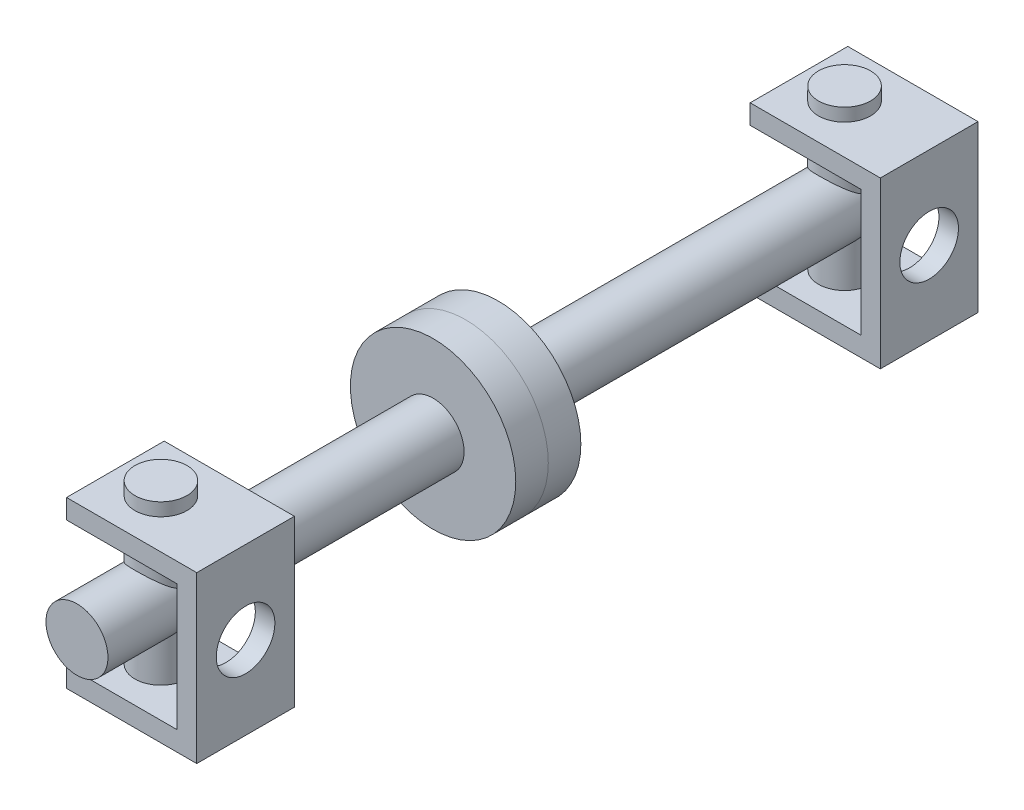
from build123d import *

# Parameters (mm, degrees)
BOSS_EXTRUDE1_DEPTH       = 15
SKETCH2_R                 = 4.5
CUT_EXTRUDE1_DEPTH        = 15
SKETCH3_R                 = 4
CUT_EXTRUDE2_DEPTH        = 36.639304146
BOSS_EXTRUDE2_DEPTH       = 2
BOSS_EXTRUDE2_DEPTH_BACK  = 27
SKETCH4_R                 = 4
SKETCH5_R                 = 2.5
CUT_EXTRUDE3_DEPTH        = 27
BOSS_EXTRUDE3_DEPTH       = 45.7
BOSS_EXTRUDE3_DEPTH_BACK  = 14
SKETCH6_R                 = 4.7625
SKETCH7_W                 = 15
SKETCH7_H                 = 25.4
BOSS_EXTRUDE4_DEPTH       = 20
SKETCH13_R                = 12.7
BOSS_EXTRUDE7_DEPTH       = 5
SKETCH16_R                = 12.7
BOSS_EXTRUDE8_DEPTH       = 5
SKETCH17_R                = 2.5
CUT_EXTRUDE6_DEPTH        = 54.7
BOSS_EXTRUDE9_START       = 54.7
SKETCH18_R                = 4.7625
BOSS_EXTRUDE9_DEPTH       = 54.7
CUT_EXTRUDE7_DEPTH        = 126.65623741
CUT_EXTRUDE7_DEPTH_BACK   = 20
SKETCH19_W                = 17
SKETCH19_H                = 19.4
SKETCH19_R                = 4.7625
SKETCH10_R                = 4
CUT_EXTRUDE8_DEPTH        = 131.906111393
BOSS_EXTRUDE10_DEPTH      = 2
BOSS_EXTRUDE10_DEPTH_BACK = 27.4
SKETCH20_R                = 4
SKETCH21_R                = 4.5
CUT_EXTRUDE9_DEPTH        = 8


with BuildPart() as part:
    # Sketch1 → Boss-Extrude1 (new body)
    with BuildSketch(Plane.XY):
        Polygon((0, 0), (0, -25.4), (-20, -25.4), (-20, -22.4), (-3, -22.4), (-3, -3), (-20, -3), (-20, 0), align=None)
    extrude(amount=BOSS_EXTRUDE1_DEPTH)

    # Sketch2 → Cut-Extrude1 (cut)
    with BuildSketch(Plane(origin=(0, 0, 0), x_dir=(0, 0, -1), z_dir=(1, 0, 0))):
        with Locations(Location((-7.5, -12.7, 0), (0, 0, 90))):
            Circle(SKETCH2_R)
    extrude(amount=-CUT_EXTRUDE1_DEPTH, mode=Mode.SUBTRACT)

    # Sketch3 → Cut-Extrude2 (cut, through all)
    with BuildSketch(Plane.XZ.offset(25.4)):
        with Locations(Location((-13, 7.5, 0), (0, 0, 270))):
            Circle(SKETCH3_R)
    extrude(amount=-CUT_EXTRUDE2_DEPTH, mode=Mode.SUBTRACT)

    # Sketch4 → Boss-Extrude2 (add, two sides: drawn at the far end of the back side and taken through both)
    with BuildSketch(Plane(origin=(0, 0, 0), x_dir=(1, 0, 0), z_dir=(0, 1, 0)).offset(-BOSS_EXTRUDE2_DEPTH_BACK)):
        with Locations(Location((-13, -7.5, 0), (0, 0, 90))):
            Circle(SKETCH4_R)
    extrude(amount=BOSS_EXTRUDE2_DEPTH + BOSS_EXTRUDE2_DEPTH_BACK)

    # Sketch5 → Cut-Extrude3 (cut)
    with BuildSketch(Plane.XY.offset(15)):
        with Locations((-13, -12.7)):
            Circle(SKETCH5_R)
    extrude(amount=-CUT_EXTRUDE3_DEPTH, mode=Mode.SUBTRACT)

    # Sketch6 → Boss-Extrude3 (add, two sides: drawn at the far end of the back side and taken through both)
    with BuildSketch(Plane.XY.offset(15).offset(-BOSS_EXTRUDE3_DEPTH_BACK)):
        with Locations((-13, -12.7)):
            Circle(SKETCH6_R)
    extrude(amount=BOSS_EXTRUDE3_DEPTH + BOSS_EXTRUDE3_DEPTH_BACK)

    # Sketch13 → Boss-Extrude7 (add)
    with BuildSketch(Plane.XY.offset(60.7)):
        with Locations((-13, -12.7)):
            Circle(SKETCH13_R)
    extrude(amount=BOSS_EXTRUDE7_DEPTH)


with BuildPart() as body_2:
    # Sketch7 → Boss-Extrude4 (new body)
    with BuildSketch(Plane(origin=(0, 0, 0), x_dir=(0, 0, -1), z_dir=(1, 0, 0))):
        with Locations((-112.5, -12.7)):
            Rectangle(SKETCH7_W, SKETCH7_H)
    extrude(amount=-BOSS_EXTRUDE4_DEPTH)

    # Sketch17 → Cut-Extrude6 (cut)
    with BuildSketch(Plane.XY.offset(70.7)):
        with Locations(Location((-13, -12.7, 0), (0, 0, 180))):
            Circle(SKETCH17_R)
    extrude(amount=CUT_EXTRUDE6_DEPTH, mode=Mode.SUBTRACT)



with BuildPart() as body_3:
    # Sketch16 → Boss-Extrude8 (new body)
    with BuildSketch(Plane.XY.offset(65.7)):
        with Locations((-13, -12.7)):
            Circle(SKETCH16_R)
    extrude(amount=BOSS_EXTRUDE8_DEPTH)


with BuildPart() as body_2_1:
    add(body_2.part)

    add(body_3.part)  # Boss-Extrude9 merges body 3
    # Sketch18 → Boss-Extrude9 (add)
    with BuildSketch(Plane.XY.offset(70.7).offset(BOSS_EXTRUDE9_START)):
        with Locations((-13, -12.7)):
            Circle(SKETCH18_R)
    extrude(amount=-BOSS_EXTRUDE9_DEPTH)

    # Sketch19 → Cut-Extrude7 (cut, two sides: drawn at the far end of the back side and taken through both)
    with BuildSketch(Plane.XY.offset(120).offset(-CUT_EXTRUDE7_DEPTH_BACK)):
        with Locations((-11.5, -12.7)):
            Rectangle(SKETCH19_W, SKETCH19_H)
        with Locations((-13, -12.7)):
            Circle(SKETCH19_R, mode=Mode.SUBTRACT)
    extrude(amount=CUT_EXTRUDE7_DEPTH + CUT_EXTRUDE7_DEPTH_BACK, mode=Mode.SUBTRACT)


with BuildPart() as cut_extrude7_piece_1:
    # of the separate pieces the step leaves, piece 1, a body of its own (cut_extrude7_pieces)
    add(body_2_1.part.solids().sort_by_distance((-0.3, -12.7, 65.7))[0])


with BuildPart() as cut_extrude7_piece_2:
    # of the separate pieces the step leaves, piece 2, a body of its own (cut_extrude7_pieces)
    add(body_2_1.part.solids().sort_by_distance((0, 0, 105))[0])


with BuildPart() as cut_extrude8_tool:
    # Sketch10 → Cut-Extrude8 (new, through all)
    with BuildSketch(Plane(origin=(0, -25.4, 0), x_dir=(-1, 0, 0), z_dir=(0, -1, 0))):
        with Locations(Location((13, -112.5, 0), (0, 0, 180))):
            Circle(SKETCH10_R)
    extrude(amount=-CUT_EXTRUDE8_DEPTH)


with BuildPart() as cut_extrude7_piece_1_1:
    add(cut_extrude7_piece_1.part)

    # Cut-Extrude8: cut by cut_extrude8_tool
    add(cut_extrude8_tool.part, mode=Mode.SUBTRACT)



with BuildPart() as cut_extrude7_piece_2_1:
    add(cut_extrude7_piece_2.part)

    # Cut-Extrude8: cut by cut_extrude8_tool
    add(cut_extrude8_tool.part, mode=Mode.SUBTRACT)


with BuildPart() as cut_extrude7_piece_1_2:
    add(cut_extrude7_piece_1_1.part)

    add(cut_extrude7_piece_2_1.part)  # Boss-Extrude10 merges Cut-Extrude7 piece 2
    # Sketch20 → Boss-Extrude10 (add, two sides: drawn at the far end of the back side and taken through both)
    with BuildSketch(Plane.XZ.offset(25.4).offset(-BOSS_EXTRUDE10_DEPTH_BACK)):
        with Locations((-13, 112.5)):
            Circle(SKETCH20_R)
    extrude(amount=BOSS_EXTRUDE10_DEPTH + BOSS_EXTRUDE10_DEPTH_BACK)

    # Sketch21 → Cut-Extrude9 (cut)
    with BuildSketch(Plane(origin=(0, 0, 0), x_dir=(0, 0, -1), z_dir=(1, 0, 0))):
        with Locations(Location((-112.5, -12.7, 0), (0, 0, 90))):
            Circle(SKETCH21_R)
    extrude(amount=-CUT_EXTRUDE9_DEPTH, mode=Mode.SUBTRACT)


solid = Compound([part.part, cut_extrude7_piece_1_2.part])
